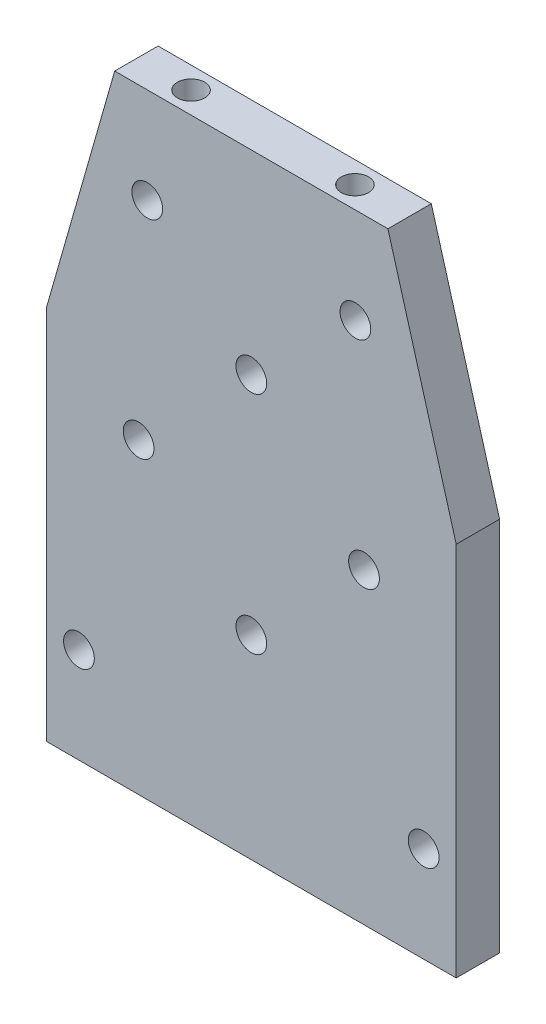
from build123d import *

# Parameters (mm, degrees)
EXTRUDE_1_4_DEPTH = 3.175
SKETCH4_R         = 2
M4_DRILL_DEPTH    = 8
SKETCH5_R         = 2
M4_DRILL2_DEPTH   = 8
SKETCH6_R         = 2.25
M4_THROUGH_DEPTH  = 6.35
SKETCH8_R         = 2.25
M4_THROUGH2_DEPTH = 10


with BuildPart() as part:
    # Sketch1 → 1/4 (new, symmetric)
    with BuildSketch(Plane.XY):
        Polygon((-20, 45), (20, 45), (30, 10), (30, -45), (-30, -45), (-30, 10), align=None)
    extrude(amount=EXTRUDE_1_4_DEPTH, both=True)

    # Sketch4 → M4_DRILL (cut)
    with BuildSketch(Plane(origin=(0, 45, 0), x_dir=(1, 0, 0), z_dir=(0, 1, 0))):
        with Locations(Location((-12, 0, 0), (0, 0, 180))):
            Circle(SKETCH4_R)
        with Locations((12, 0)):
            Circle(SKETCH4_R)
    extrude(amount=-M4_DRILL_DEPTH, mode=Mode.SUBTRACT)

    # Sketch5 → M4_DRILL2 (cut)
    with BuildSketch(Plane(origin=(0, -45, 0), x_dir=(-1, 0, 0), z_dir=(0, -1, 0))):
        with Locations(Location((-20, 0, 0), (0, 0, 180))):
            Circle(SKETCH5_R)
        with Locations((20, 0)):
            Circle(SKETCH5_R)
        with Locations(Location((0, 0, 0), (0, 0, 180))):
            Circle(SKETCH5_R)
    extrude(amount=-M4_DRILL2_DEPTH, mode=Mode.SUBTRACT)

    # Sketch6 → M4_through (cut)
    with BuildSketch(Plane.XY.offset(3.175)):
        with Locations((-25.2375, -31)):
            Circle(SKETCH6_R)
        with Locations((25.2375, -31)):
            Circle(SKETCH6_R)
        with Locations((-15.2375, 31)):
            Circle(SKETCH6_R)
        with Locations((15.2375, 31)):
            Circle(SKETCH6_R)
    extrude(amount=-M4_THROUGH_DEPTH, mode=Mode.SUBTRACT)

    # Sketch8 → M4_through2 (cut)
    with BuildSketch(Plane(origin=(0, 0, -3.175), x_dir=(-1, 0, 0), z_dir=(0, 0, -1))):
        with Locations((0, 16.5)):
            Circle(SKETCH8_R)
        with Locations((16.5, 0)):
            Circle(SKETCH8_R)
        with Locations((0, -16.5)):
            Circle(SKETCH8_R)
        with Locations((-16.5, 0)):
            Circle(SKETCH8_R)
    extrude(amount=-M4_THROUGH2_DEPTH, mode=Mode.SUBTRACT)


solid = part.part
